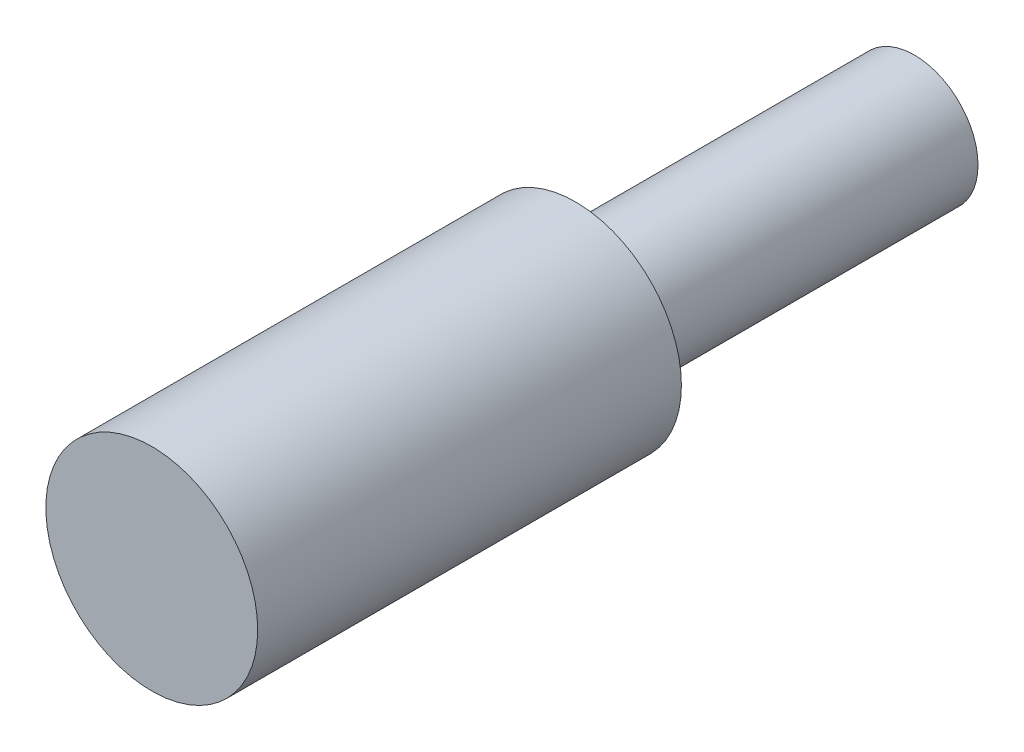
from build123d import *

# Parameters (mm, degrees)
SKETCH_1_R          = 25
EXTRUDE_1_DEPTH     = 100
SKETCH_2_R          = 15
EXTRUDE_2_DEPTH     = 80
SKETCH_3_W          = 8
SKETCH_3_H          = 30
CUT_EXTRUDE_1_DEPTH = 4


with BuildPart() as part:
    # 草图1 → 凸台-拉伸1 (new body)
    with BuildSketch(Plane.XY):
        Circle(SKETCH_1_R)
    extrude(amount=EXTRUDE_1_DEPTH)

    # 草图2 → 凸台-拉伸2 (add)
    with BuildSketch(Plane.XY):
        Circle(SKETCH_2_R)
    extrude(amount=-EXTRUDE_2_DEPTH)

    # 草图3 → 切除-拉伸1 (cut)
    with BuildSketch(Plane(origin=(0, 0, 0), x_dir=(1, 0, 0), z_dir=(0, 1, 0))):
        with Locations((0, -35)):
            Rectangle(SKETCH_3_W, SKETCH_3_H)
    extrude(amount=CUT_EXTRUDE_1_DEPTH, mode=Mode.SUBTRACT)


solid = part.part
